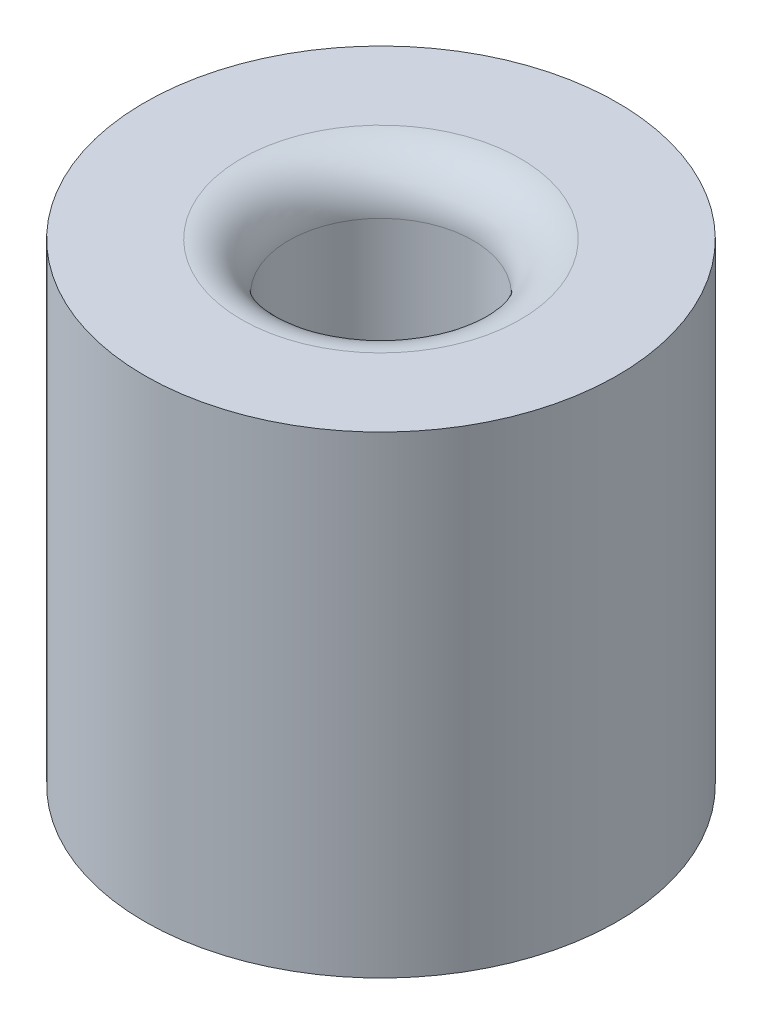
from build123d import *

# Parameters (mm, degrees)
SKETCH_1_R          = 5
EXTRUDE_1_DEPTH     = 10
SKETCH_2_R          = 1.95
CUT_EXTRUDE_1_DEPTH = 8.6
FILLET_1_R          = 1


with BuildPart() as part:
    # Эскиз1 → Бобышка-Вытянуть1 (new body)
    with BuildSketch(Plane(origin=(0, 0, 0), x_dir=(1, 0, 0), z_dir=(0, 1, 0))):
        with Locations(Location((0, 0, 0), (0, 0, 270))):
            Circle(SKETCH_1_R)
    extrude(amount=EXTRUDE_1_DEPTH)

    # Эскиз2 → Вырез-Вытянуть1 (cut)
    with BuildSketch(Plane(origin=(0, 10, 0), x_dir=(1, 0, 0), z_dir=(0, 1, 0))):
        with Locations(Location((0, 0, 0), (0, 0, 270))):
            Circle(SKETCH_2_R)
    extrude(amount=-CUT_EXTRUDE_1_DEPTH, mode=Mode.SUBTRACT)

    # Скругление1
    fillet_1_edges = [part.edges().sort_by_distance(p)[0] for p in [
        (0, 10, -1.95),
    ]]
    fillet(fillet_1_edges, radius=FILLET_1_R)


solid = part.part
